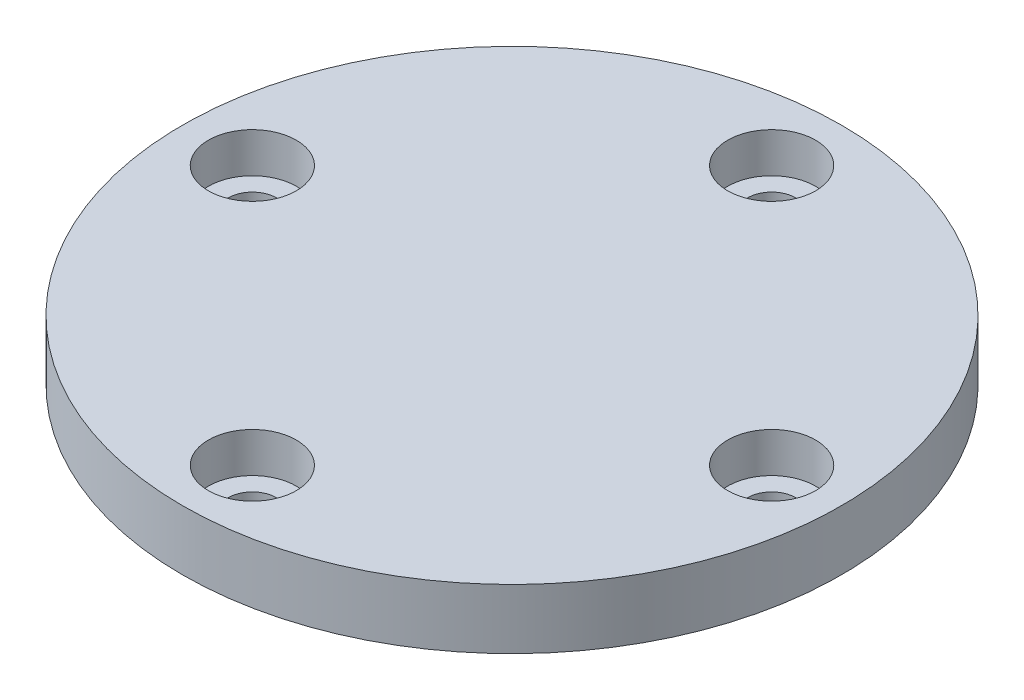
from build123d import *

# Parameters (mm, degrees)
SKETCH1_R                      = 16.5
BOSS_EXTRUDE1_DEPTH            = 3
CBORE_FOR_M2_SHCS1_D           = 2.4
CBORE_FOR_M2_SHCS1_CBORE_D     = 4.4
CBORE_FOR_M2_SHCS1_CBORE_DEPTH = 2
CIRPATTERN1_COUNT              = 4
SKETCH8_R                      = 0.5
CUT_EXTRUDE1_DEPTH             = 1.5


with BuildPart() as part:
    # Sketch1 → Boss-Extrude1 (new body)
    with BuildSketch(Plane(origin=(0, 0, 0), x_dir=(1, 0, 0), z_dir=(0, 1, 0))):
        with Locations(Location((0, 0, 0), (0, 0, 270))):
            Circle(SKETCH1_R)
    extrude(amount=BOSS_EXTRUDE1_DEPTH)

    # CBORE for M2 SHCS1 (through all)
    with Locations(Plane(origin=(0, 3, 0), x_dir=(1, 0, 0), z_dir=(0, 1, 0))):
        with Locations((13, 0)):
            cbore_for_m2_shcs1 = CounterBoreHole(CBORE_FOR_M2_SHCS1_D / 2, CBORE_FOR_M2_SHCS1_CBORE_D / 2, CBORE_FOR_M2_SHCS1_CBORE_DEPTH)

    # CirPattern1: CBORE for M2 SHCS1 ×4 about axis
    cirpattern1_axis = Axis((0, 0, 0), (0, 1, 0))
    for i in range(1, CIRPATTERN1_COUNT):
        add(cbore_for_m2_shcs1.rotate(cirpattern1_axis, i * 360 / CIRPATTERN1_COUNT), mode=Mode.SUBTRACT)

    # Sketch8 → Cut-Extrude1 (cut)
    with BuildSketch(Plane.XZ):
        with Locations(Location((6, 0, 0), (0, 0, 270))):
            Circle(SKETCH8_R)
    extrude(amount=-CUT_EXTRUDE1_DEPTH, mode=Mode.SUBTRACT)


solid = part.part
